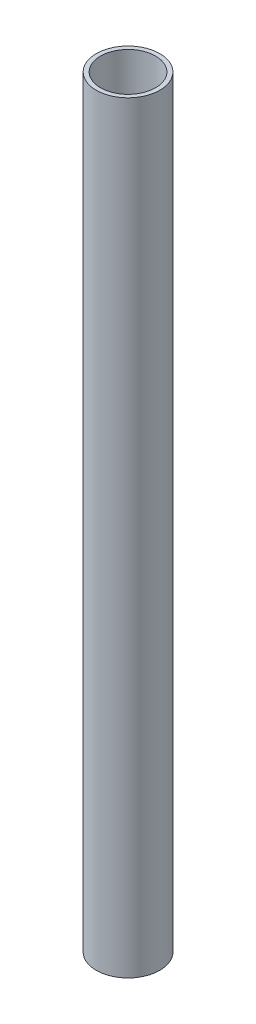
from build123d import *

# Parameters (mm, degrees)
SKETCH1_R           = 7.5
SKETCH1_R_2         = 6.5
BOSS_EXTRUDE1_DEPTH = 180


with BuildPart() as part:
    # Sketch1 → Boss-Extrude1 (new body)
    with BuildSketch(Plane(origin=(0, 0, 0), x_dir=(1, 0, 0), z_dir=(0, 1, 0))):
        with Locations(Location((0, 0, 0), (0, 0, 90))):
            Circle(SKETCH1_R)
        with Locations(Location((0, 0, 0), (0, 0, 90))):
            Circle(SKETCH1_R_2, mode=Mode.SUBTRACT)
    extrude(amount=BOSS_EXTRUDE1_DEPTH)


solid = part.part
